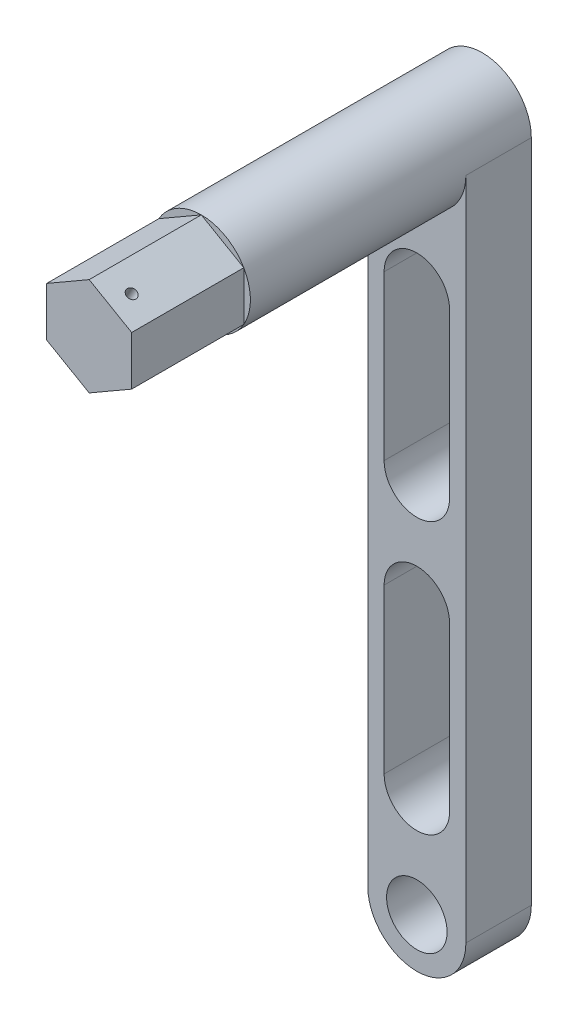
from build123d import *

# Parameters (mm, degrees)
SKETCH1_R               = 4.625
BOSS_EXTRUDE1_DEPTH     = 10
BOSS_EXTRUDE2_DEPTH     = 42.94
BOSS_EXTRUDE3_DEPTH     = 17.14
CUT_EXTRUDE1_DEPTH      = 123.845099649
CUT_EXTRUDE1_DEPTH_BACK = 123.845099649
SKETCH4_R               = 0.75


with BuildPart() as part:
    # Sketch1 → Boss-Extrude1 (new body)
    with BuildSketch(Plane.XY):
        with BuildLine():
            Line((-7.5, 50.8), (-7.5, -50.8))
            ThreePointArc((-7.5, -50.8), (0, -58.3), (7.5, -50.8))
            Line((7.5, -50.8), (7.5, 50.8))
            ThreePointArc((7.5, 50.8), (0, 43.3), (-7.5, 50.8))
        make_face()
        with Locations((0, -50.8)):
            Circle(SKETCH1_R, mode=Mode.SUBTRACT)
        with BuildLine():
            ThreePointArc((5, -34.675), (0, -39.675), (-5, -34.675))
            Line((-5, -34.675), (-5, -9.675))
            ThreePointArc((-5, -9.675), (0, -4.675), (5, -9.675))
            Line((5, -9.675), (5, -34.675))
        make_face(mode=Mode.SUBTRACT)
        with BuildLine():
            ThreePointArc((-5, 31.8), (0, 36.8), (5, 31.8))
            Line((5, 31.8), (5, 6.8))
            ThreePointArc((5, 6.8), (0, 1.8), (-5, 6.8))
            Line((-5, 6.8), (-5, 31.8))
        make_face(mode=Mode.SUBTRACT)
    extrude(amount=BOSS_EXTRUDE1_DEPTH)

    # Sketch1<4> → Boss-Extrude2 (add)
    with BuildSketch(Plane.XY):
        with BuildLine():
            ThreePointArc((7.5, 50.8), (0, 58.3), (-7.5, 50.8))
            ThreePointArc((-7.5, 50.8), (0, 43.3), (7.5, 50.8))
        make_face()
    extrude(amount=BOSS_EXTRUDE2_DEPTH)

    # Sketch3 → Boss-Extrude3 (add)
    with BuildSketch(Plane.XY.offset(42.94)):
        Polygon((0, 43.3), (6.495190528, 47.05), (6.495190528, 54.55), (0, 58.3), (-6.495190528, 54.55), (-6.495190528, 47.05), align=None)
    extrude(amount=BOSS_EXTRUDE3_DEPTH)

    # Sketch4 → Cut-Extrude1 (cut, two sides: drawn at the far end of the back side and taken through both)
    with BuildSketch(Plane(origin=(25.24464052, 43.725, 0), x_dir=(0.8660254037844416, -0.499999999999995, 0), z_dir=(0.49999999999999495, 0.8660254037844415, 0)).offset(-CUT_EXTRUDE1_DEPTH_BACK)):
        with Locations((-25.4, -56.83)):
            Circle(SKETCH4_R)
    extrude(amount=CUT_EXTRUDE1_DEPTH + CUT_EXTRUDE1_DEPTH_BACK, mode=Mode.SUBTRACT)


solid = part.part
